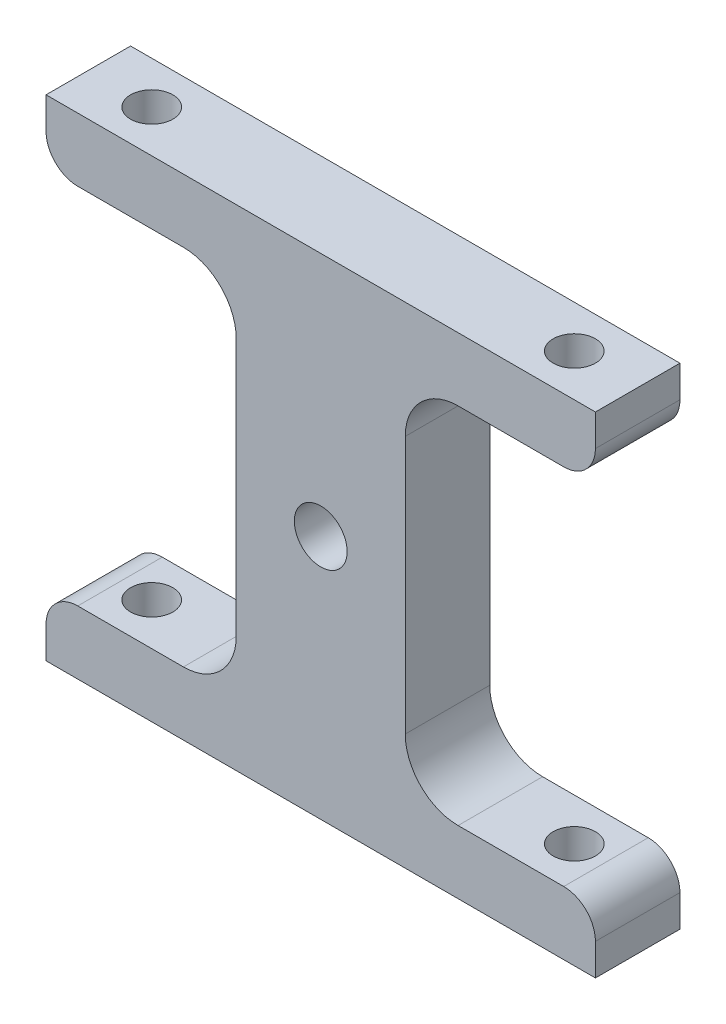
from build123d import *

# Parameters (mm, degrees)
SKETCH_1_R          = 2.5
EXTRUDE_1_DEPTH     = 8
SKETCH_2_R          = 2
CUT_EXTRUDE_1_DEPTH = 54.786243594
FILLET_1_R          = 3
FILLET_2_R          = 5


with BuildPart() as part:
    # 草图1 → 凸台-拉伸1 (new body)
    with BuildSketch(Plane.XY):
        Polygon((-8, -17.2), (-8, 17.2), (-26, 17.2), (-26, 23.2), (26, 23.2), (26, 17.2), (8, 17.2), (8, -17.2), (26, -17.2), (26, -23.2), (-26, -23.2), (-26, -17.2), align=None)
        Circle(SKETCH_1_R, mode=Mode.SUBTRACT)
    extrude(amount=EXTRUDE_1_DEPTH)

    # 草图2 → 切除-拉伸1 (cut, through all)
    with BuildSketch(Plane(origin=(0, 23.2, 0), x_dir=(1, 0, 0), z_dir=(0, 1, 0))):
        with Locations(Location((-20, -4, 0), (0, 0, 270))):
            Circle(SKETCH_2_R)
        with Locations(Location((20, -4, 0), (0, 0, 270))):
            Circle(SKETCH_2_R)
    extrude(amount=-CUT_EXTRUDE_1_DEPTH, mode=Mode.SUBTRACT)

    # 圆角1
    fillet_1_edges = [part.edges().sort_by_distance(p)[0] for p in [
        (-26, 17.2, 4),
        (26, 17.2, 4),
        (26, -17.2, 4),
        (-26, -17.2, 4),
    ]]
    fillet(fillet_1_edges, radius=FILLET_1_R)

    # 圆角2
    fillet_2_edges = [part.edges().sort_by_distance(p)[0] for p in [
        (8, 17.2, 4),
        (8, -17.2, 4),
        (-8, -17.2, 4),
        (-8, 17.2, 4),
    ]]
    fillet(fillet_2_edges, radius=FILLET_2_R)


solid = part.part
